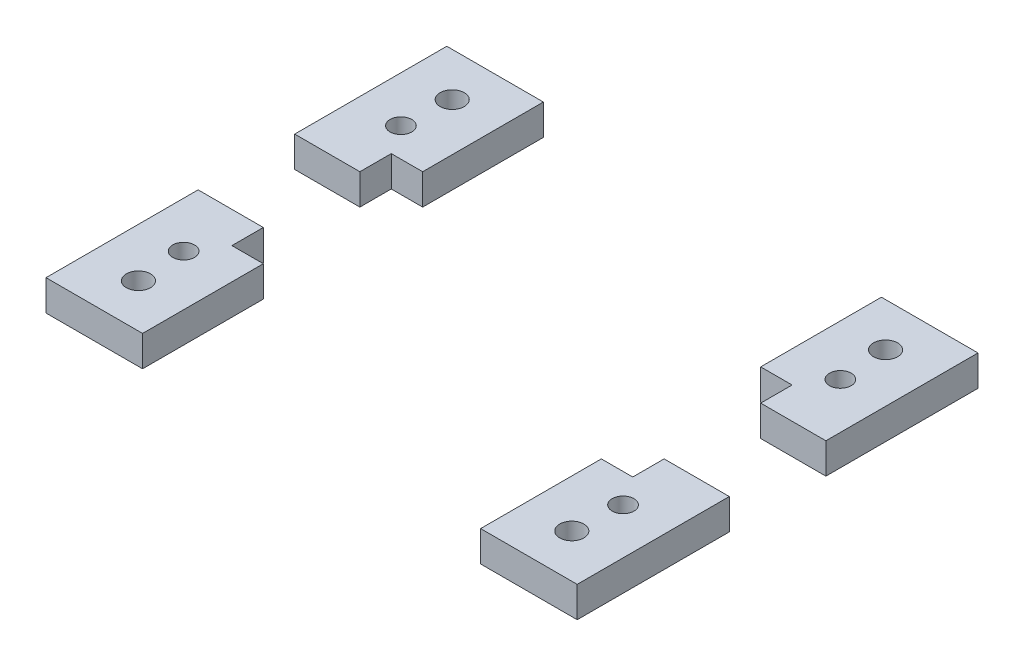
from build123d import *

# Parameters (mm, degrees)
EXTRUDE_THIN1_DEPTH      = 3.175
EXTRUDE_THIN1_DEPTH_BACK = 3.175
SKETCH1_W                = 133
SKETCH1_H                = 83
SKETCH1_W_2              = 83
SKETCH1_H_2              = 33
CUT_EXTRUDE3_DEPTH       = 79.451135269
CUT_EXTRUDE3_DEPTH_BACK  = 79.451135269
SKETCH2_W                = 70
SKETCH2_H                = 100
CUT_EXTRUDE4_DEPTH       = 69.973405201
CUT_EXTRUDE4_DEPTH_BACK  = 69.973405201
SKETCH3_R                = 2.25
SKETCH3_R_2              = 2.5


with BuildPart() as part:
    # Sketch1 → Extrude-Thin1 (new, two sides: drawn at the far end of the back side and taken through both)
    with BuildSketch(Plane(origin=(0, 0, 0), x_dir=(1, 0, 0), z_dir=(0, 1, 0)).offset(-EXTRUDE_THIN1_DEPTH_BACK)):
        Rectangle(SKETCH1_W, SKETCH1_H)
        Rectangle(SKETCH1_W_2, SKETCH1_H_2, mode=Mode.SUBTRACT)
    extrude(amount=EXTRUDE_THIN1_DEPTH + EXTRUDE_THIN1_DEPTH_BACK)

    # Sketch2 → Cut-Extrude3 (cut, two sides: drawn at the far end of the back side and taken through both)
    with BuildSketch(Plane(origin=(0, 0, 0), x_dir=(1, 0, 0), z_dir=(0, 1, 0)).offset(-CUT_EXTRUDE3_DEPTH_BACK)):
        Polygon((-75, 10), (-66.5, 10), (-66.5, 41.5), (-55, 41.5), (-55, 10), (55, 10), (55, 41.5), (66.5, 41.5), (66.5, 10), (75, 10), (75, -10), (66.5, -10), (66.5, -41.5), (55, -41.5), (55, -10), (-55, -10), (-55, -41.5), (-66.5, -41.5), (-66.5, -10), (-75, -10), align=None)
        Rectangle(SKETCH2_W, SKETCH2_H)
    extrude(amount=CUT_EXTRUDE3_DEPTH + CUT_EXTRUDE3_DEPTH_BACK, mode=Mode.SUBTRACT)


with BuildPart() as cut_extrude3_piece_1:
    # of the separate pieces the step leaves, piece 1, a body of its own (cut_extrude3_pieces)
    add(part.part.solids().sort_by_distance((55, 3.175, 41.5))[0])


with BuildPart() as cut_extrude3_piece_2:
    # of the separate pieces the step leaves, piece 2, a body of its own (cut_extrude3_pieces)
    add(part.part.solids().sort_by_distance((41.5, -3.175, -10))[0])


with BuildPart() as cut_extrude3_piece_3:
    # of the separate pieces the step leaves, piece 3, a body of its own (cut_extrude3_pieces)
    add(part.part.solids().sort_by_distance((-55, -3.175, -41.5))[0])


with BuildPart() as cut_extrude3_piece_4:
    # of the separate pieces the step leaves, piece 4, a body of its own (cut_extrude3_pieces)
    add(part.part.solids().sort_by_distance((-35, -3.175, 41.5))[0])


with BuildPart() as cut_extrude4_tool:
    # Sketch3 → Cut-Extrude4 (new, two sides: drawn at the far end of the back side and taken through both)
    with BuildSketch(Plane(origin=(0, 0, 0), x_dir=(1, 0, 0), z_dir=(0, 1, 0)).offset(-CUT_EXTRUDE4_DEPTH_BACK)):
        with Locations(Location((-45.5, 22.5, 0), (0, 0, 270))):
            Circle(SKETCH3_R)
        with Locations(Location((45.5, 22.5, 0), (0, 0, 90))):
            Circle(SKETCH3_R)
        with Locations(Location((45.5, -22.5, 0), (0, 0, 270))):
            Circle(SKETCH3_R)
        with Locations(Location((-45.5, -22.5, 0), (0, 0, 90))):
            Circle(SKETCH3_R)
        with Locations(Location((-44.871622394, 32.488094285, 0), (0, 0, 270))):
            Circle(SKETCH3_R_2)
        with Locations(Location((-44.871622394, -32.488094285, 0), (0, 0, 90))):
            Circle(SKETCH3_R_2)
        with Locations(Location((44.871622394, -32.488094285, 0), (0, 0, 270))):
            Circle(SKETCH3_R_2)
        with Locations(Location((44.871622394, 32.488094285, 0), (0, 0, 90))):
            Circle(SKETCH3_R_2)
    extrude(amount=CUT_EXTRUDE4_DEPTH + CUT_EXTRUDE4_DEPTH_BACK)


with BuildPart() as cut_extrude3_piece_1_1:
    add(cut_extrude3_piece_1.part)

    # Cut-Extrude4: cut by cut_extrude4_tool
    add(cut_extrude4_tool.part, mode=Mode.SUBTRACT)


with BuildPart() as cut_extrude3_piece_2_1:
    add(cut_extrude3_piece_2.part)

    # Cut-Extrude4: cut by cut_extrude4_tool
    add(cut_extrude4_tool.part, mode=Mode.SUBTRACT)


with BuildPart() as cut_extrude3_piece_3_1:
    add(cut_extrude3_piece_3.part)

    # Cut-Extrude4: cut by cut_extrude4_tool
    add(cut_extrude4_tool.part, mode=Mode.SUBTRACT)


with BuildPart() as cut_extrude3_piece_4_1:
    add(cut_extrude3_piece_4.part)

    # Cut-Extrude4: cut by cut_extrude4_tool
    add(cut_extrude4_tool.part, mode=Mode.SUBTRACT)


solid = Compound([cut_extrude3_piece_1_1.part, cut_extrude3_piece_2_1.part, cut_extrude3_piece_3_1.part, cut_extrude3_piece_4_1.part])
